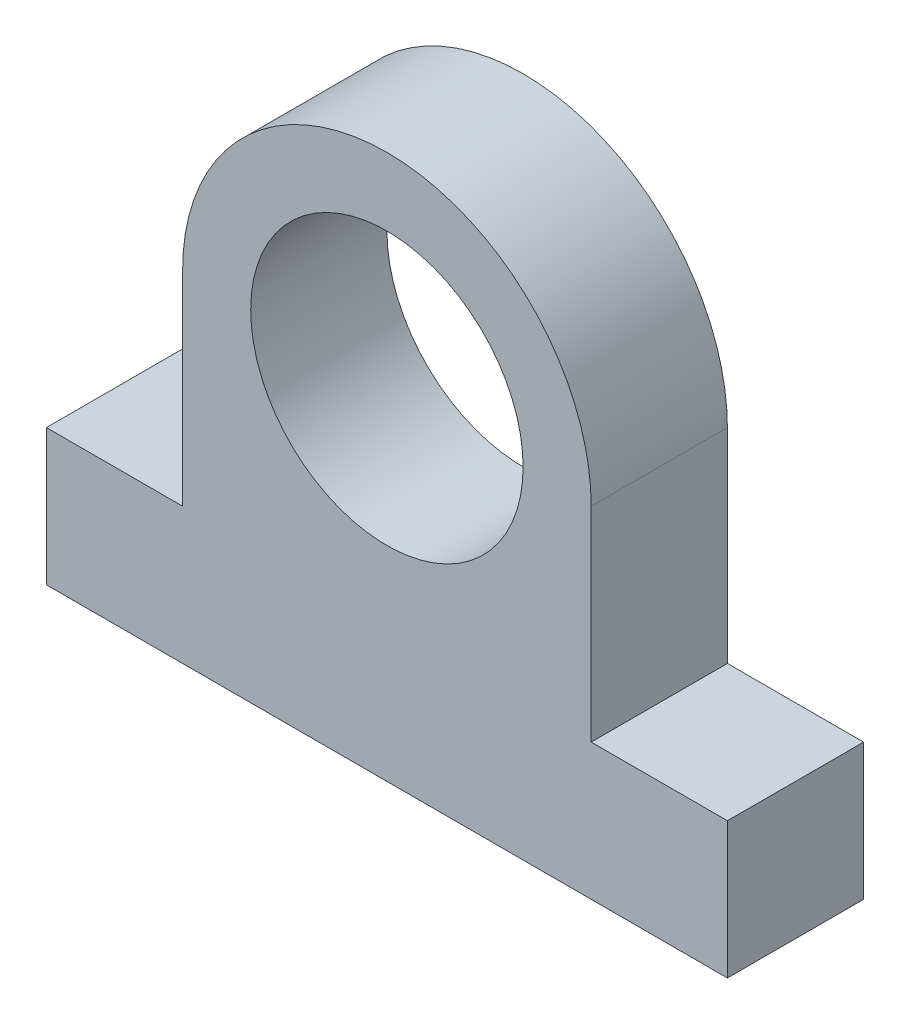
from build123d import *

# Parameters (mm, degrees)
SKETCH1_R      = 10
SKETCH1_W      = 50
SKETCH1_H      = 10
EXTRUDE1_DEPTH = 10


with BuildPart() as part:
    # Sketch1 → Extrude1 (new body)
    # profile 1 of 2: a face of its own
    with BuildSketch(Plane.XY):
        with BuildLine():
            Line((-14.889688552, 19.935237795), (-14.889688552, 4.935237795))
            Line((-14.889688552, 4.935237795), (15.110311448, 4.935237795))
            Line((15.110311448, 4.935237795), (15.110311448, 19.935237795))
            ThreePointArc((15.110311448, 19.935237795), (0.110311448, 34.935237795), (-14.889688552, 19.935237795))
        make_face()
        with Locations((0.110311448, 19.935237795)):
            Circle(SKETCH1_R, mode=Mode.SUBTRACT)
    # profile 2 of 2: a face of its own
    with BuildSketch(Plane.XY):
        with Locations((0.110311448, -0.064762205)):
            Rectangle(SKETCH1_W, SKETCH1_H)
    extrude(amount=EXTRUDE1_DEPTH)


solid = part.part
